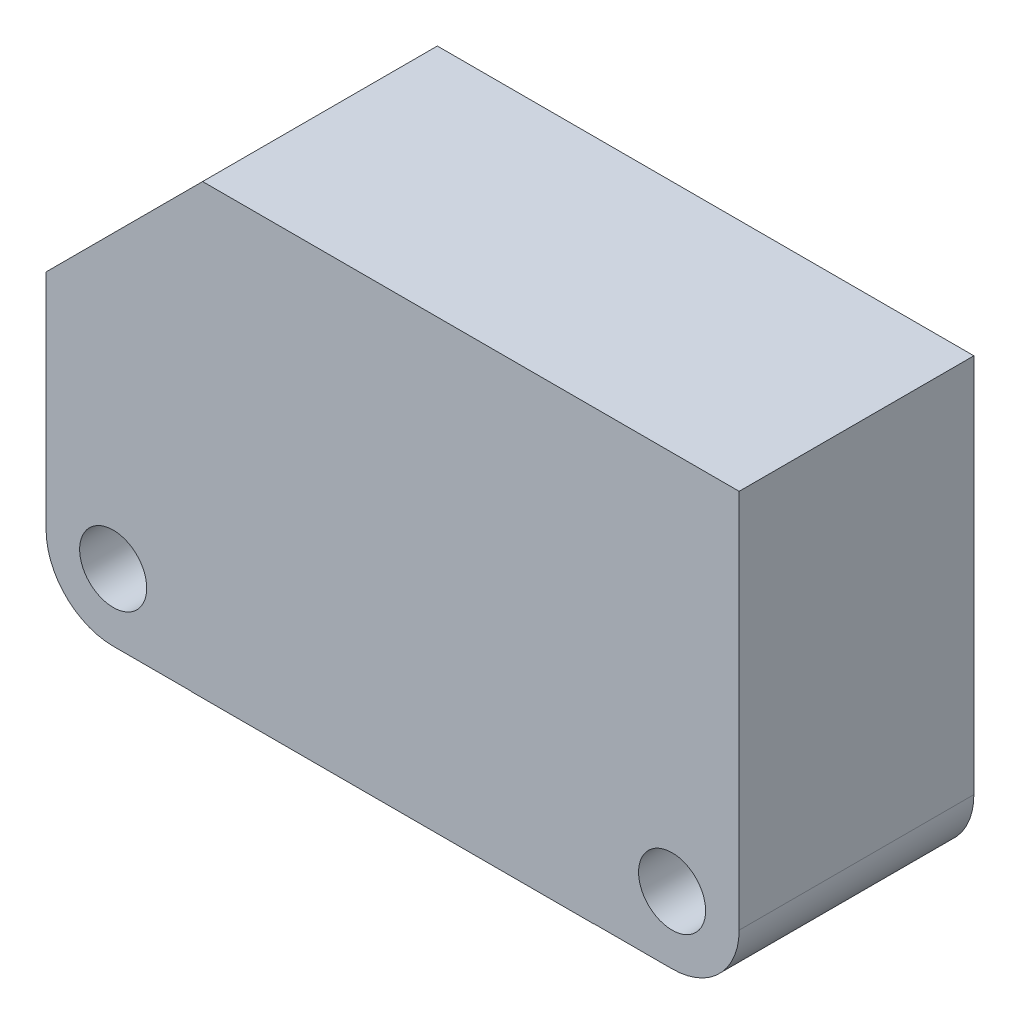
from build123d import *

# Parameters (mm, degrees)
BOSS_EXTRU_1_DEPTH      = 10.5
ESQUISSE2_R             = 1.5
ENL_V_MAT_EXTRU_1_DEPTH = 39.356876828
CONG_1_R                = 3
ESQUISSE3_W             = 18
ESQUISSE3_H             = 10.5
BOSS_EXTRU_2_DEPTH      = 0.01


with BuildPart() as part:
    # Esquisse1 → Boss.-Extru.1 (new body)
    with BuildSketch(Plane.XY):
        Polygon((0, 0), (31, 0), (31, 20), (7, 20), (0, 13), align=None)
    extrude(amount=-BOSS_EXTRU_1_DEPTH)

    # Esquisse2 → Enlèv. mat.-Extru.1 (cut, through all)
    with BuildSketch(Plane.XY):
        with Locations((3, 3)):
            Circle(ESQUISSE2_R)
        with Locations((28, 3)):
            Circle(ESQUISSE2_R)
    extrude(amount=-ENL_V_MAT_EXTRU_1_DEPTH, mode=Mode.SUBTRACT)

    # Congé1
    cong_1_edges = [part.edges().sort_by_distance(p)[0] for p in [
        (31, 0, -5.25),
        (0, 0, -5.25),
    ]]
    fillet(cong_1_edges, radius=CONG_1_R)

    # Esquisse3 → Boss.-Extru.2 (add)
    with BuildSketch(Plane.XZ):
        with Locations((15.5, -5.25)):
            Rectangle(ESQUISSE3_W, ESQUISSE3_H)
    extrude(amount=BOSS_EXTRU_2_DEPTH)


solid = part.part
